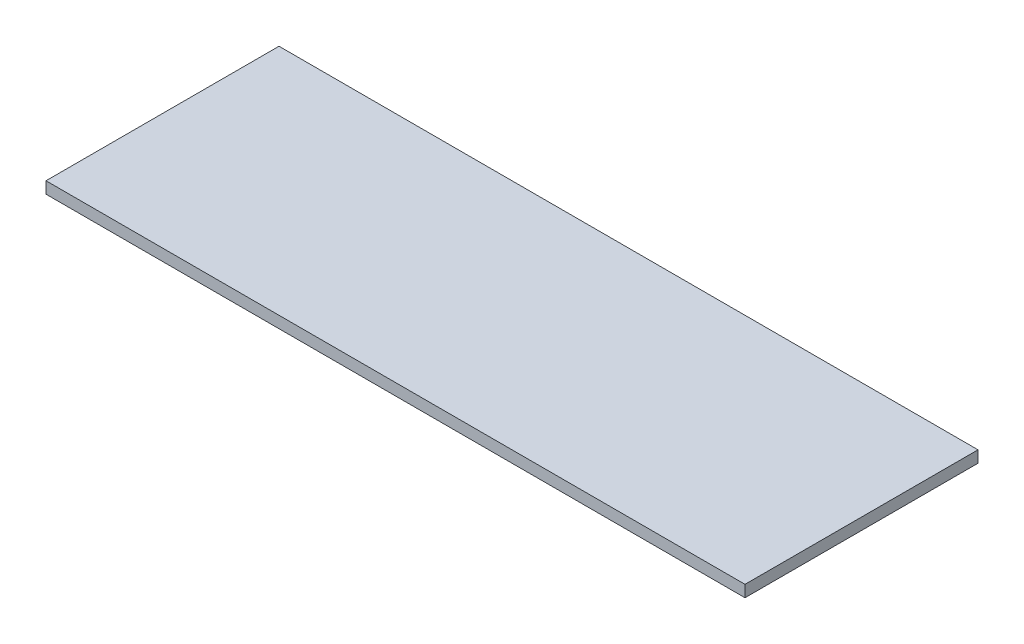
from build123d import *

# Parameters (mm, degrees)
SKETCH1_W           = 300
SKETCH1_H           = 100
BOSS_EXTRUDE1_DEPTH = 5


with BuildPart() as part:
    # Sketch1 → Boss-Extrude1 (new body)
    with BuildSketch(Plane(origin=(0, 0, 0), x_dir=(1, 0, 0), z_dir=(0, 1, 0))):
        with Locations((150, -50)):
            Rectangle(SKETCH1_W, SKETCH1_H)
    extrude(amount=BOSS_EXTRUDE1_DEPTH)


solid = part.part
